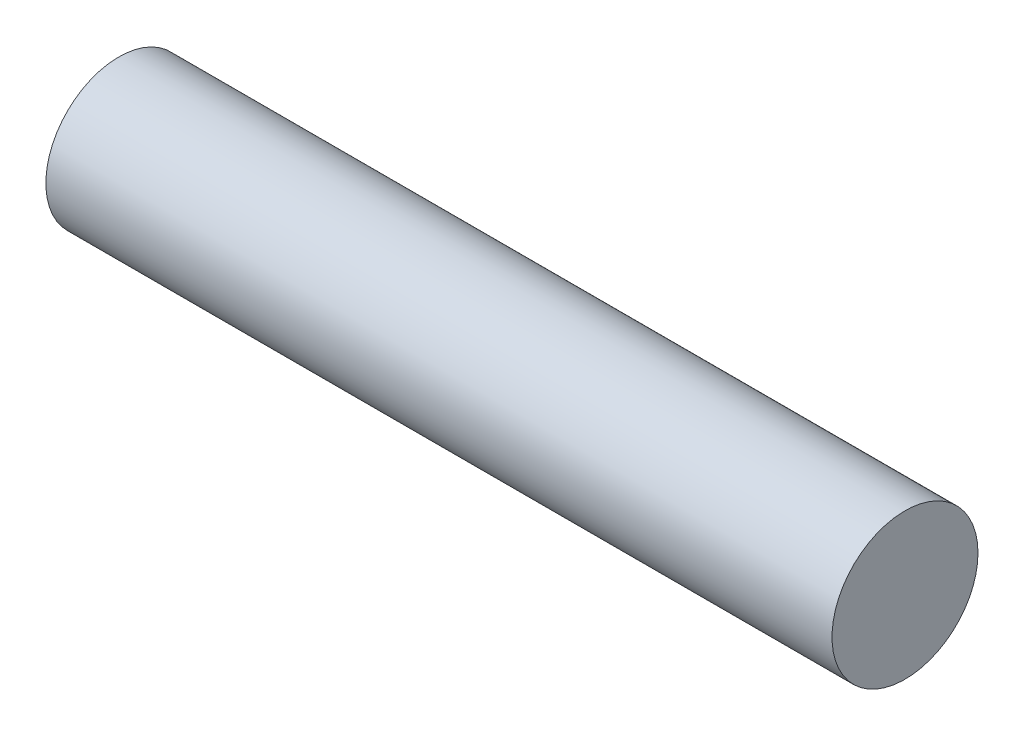
from build123d import *

# Parameters (mm, degrees)
ESQUISSE1_R      = 0.65
EXTRUSION1_DEPTH = 7


with BuildPart() as part:
    # Esquisse1 → Extrusion1 (new body)
    with BuildSketch(Plane(origin=(0, 0, 0), x_dir=(0, 0, -1), z_dir=(1, 0, 0))):
        Circle(ESQUISSE1_R)
    extrude(amount=EXTRUSION1_DEPTH)


solid = part.part
